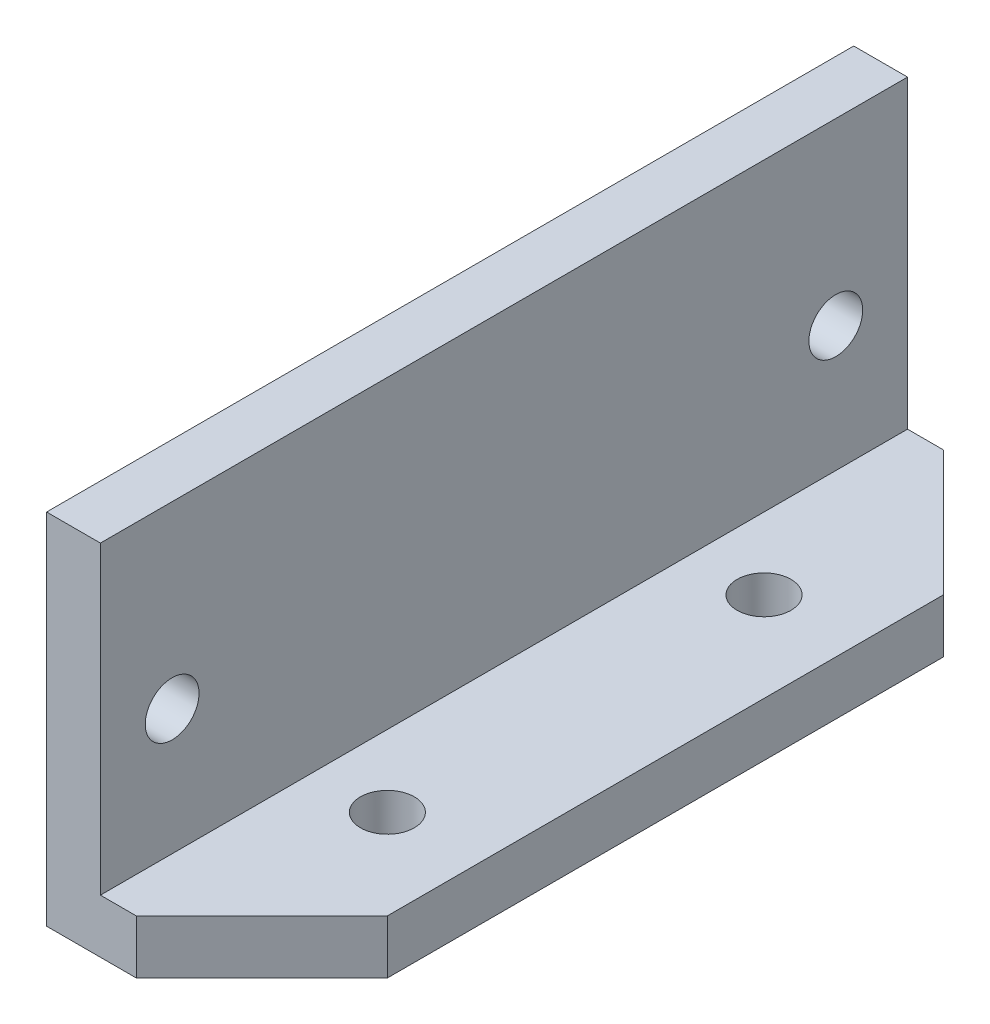
from build123d import *

# Parameters (mm, degrees)
EXTRUDE_1_DEPTH     = 45
SKETCH_3_R          = 1.5
CUT_EXTRUDE_1_DEPTH = 50.738044303
SKETCH_2_R          = 1.5
CUT_EXTRUDE_2_DEPTH = 51.68530359
CUT_EXTRUDE_3_DEPTH = 50.738044303


with BuildPart() as part:
    # 草图1 → 凸台-拉伸1 (new body)
    with BuildSketch(Plane.XY):
        Polygon((-2.009073658, 20), (-2.009073658, 3), (6.990926342, 3), (6.990926342, 0), (-5.009073658, 0), (-5.009073658, 20), align=None)
    extrude(amount=EXTRUDE_1_DEPTH)

    # 草图3 → 切除-拉伸1 (cut, through all)
    with BuildSketch(Plane.XZ):
        with Locations((1.990926342, 33)):
            Circle(SKETCH_3_R)
        with Locations(Location((1.990926342, 12, 0), (0, 0, 270))):
            Circle(SKETCH_3_R)
    extrude(amount=-CUT_EXTRUDE_1_DEPTH, mode=Mode.SUBTRACT)

    # 草图2 → 切除-拉伸2 (cut, through all)
    with BuildSketch(Plane.ZY.offset(5.009073658)):
        with Locations((4, 10)):
            Circle(SKETCH_2_R)
        with Locations(Location((41, 10, 0), (0, 0, 270))):
            Circle(SKETCH_2_R)
    extrude(amount=-CUT_EXTRUDE_2_DEPTH, mode=Mode.SUBTRACT)

    # 草图4 → 切除-拉伸3 (cut, through all)
    with BuildSketch(Plane.XZ):
        Polygon((-0.009073658, 45), (6.990926342, 38), (6.990926342, 45), align=None)
        Polygon((6.990926342, 7), (6.990926342, 0), (-0.009073658, 0), align=None)
    extrude(amount=-CUT_EXTRUDE_3_DEPTH, mode=Mode.SUBTRACT)


solid = part.part
